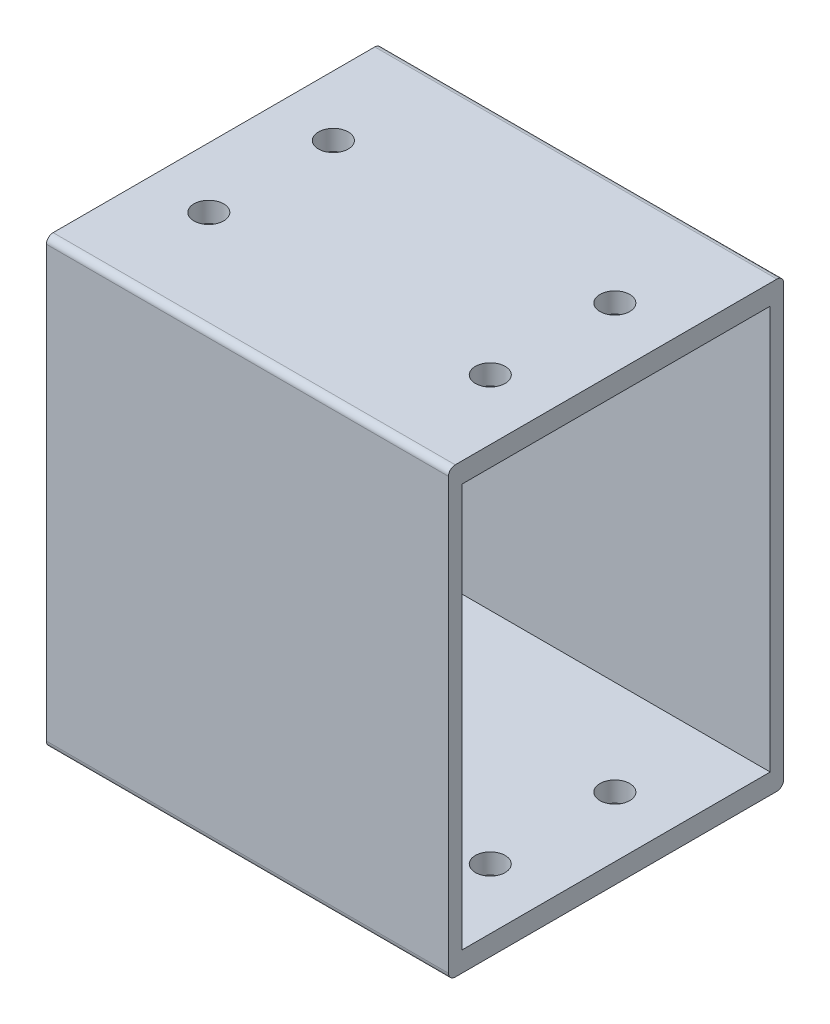
from build123d import *

# Parameters (mm, degrees)
SKETCH2_W               = 63.5
SKETCH2_H               = 84.074
BOSS_EXTRUDE1_DEPTH     = 76.2
CUT_EXTRUDE1_REACH      = 94.637
SKETCH6_W               = 58.42
SKETCH6_H               = 76.454
FILLET1_R               = 1.27
CUT_EXTRUDE3_DEPTH      = 118.825888395
CUT_EXTRUDE3_DEPTH_BACK = 118.825888395
SKETCH7_R               = 2.8194


with BuildPart() as part:
    # Sketch2 → Boss-Extrude1 (new body)
    with BuildSketch(Plane(origin=(0, 0, 0), x_dir=(0, 0, -1), z_dir=(1, 0, 0))):
        Rectangle(SKETCH2_W, SKETCH2_H)
    extrude(amount=BOSS_EXTRUDE1_DEPTH)

    # Sketch6 → Cut-Extrude1 (cut, up to next)
    with BuildSketch(Plane.ZY, mode=Mode.PRIVATE) as cut_extrude1_sk1:
        Rectangle(SKETCH6_W, SKETCH6_H)
    cut_extrude1_tool1 = extrude(cut_extrude1_sk1.sketch, amount=-CUT_EXTRUDE1_REACH, mode=Mode.PRIVATE) & part.part
    add(cut_extrude1_tool1.solids().sort_by_distance((0, 0, 0))[0], mode=Mode.SUBTRACT)

    # Fillet1
    fillet1_edges = [part.edges().sort_by_distance(p)[0] for p in [
        (38.1, -42.037, -31.75),
        (38.1, -42.037, 31.75),
        (38.1, 42.037, 31.75),
        (38.1, 42.037, -31.75),
    ]]
    fillet(fillet1_edges, radius=FILLET1_R)

    # Sketch7 → Cut-Extrude3 (cut, two sides: drawn at the far end of the back side and taken through both)
    with BuildSketch(Plane.XZ.offset(42.037).offset(-CUT_EXTRUDE3_DEPTH_BACK)):
        with Locations(Location((11.43, 12.4079, 0), (0, 0, 270))):
            Circle(SKETCH7_R)
        with Locations(Location((64.77, 12.4079, 0), (0, 0, 270))):
            Circle(SKETCH7_R)
        with Locations(Location((11.43, -11.2014, 0), (0, 0, 270))):
            Circle(SKETCH7_R)
        with Locations(Location((64.77, -11.2014, 0), (0, 0, 270))):
            Circle(SKETCH7_R)
    extrude(amount=CUT_EXTRUDE3_DEPTH + CUT_EXTRUDE3_DEPTH_BACK, mode=Mode.SUBTRACT)


solid = part.part
